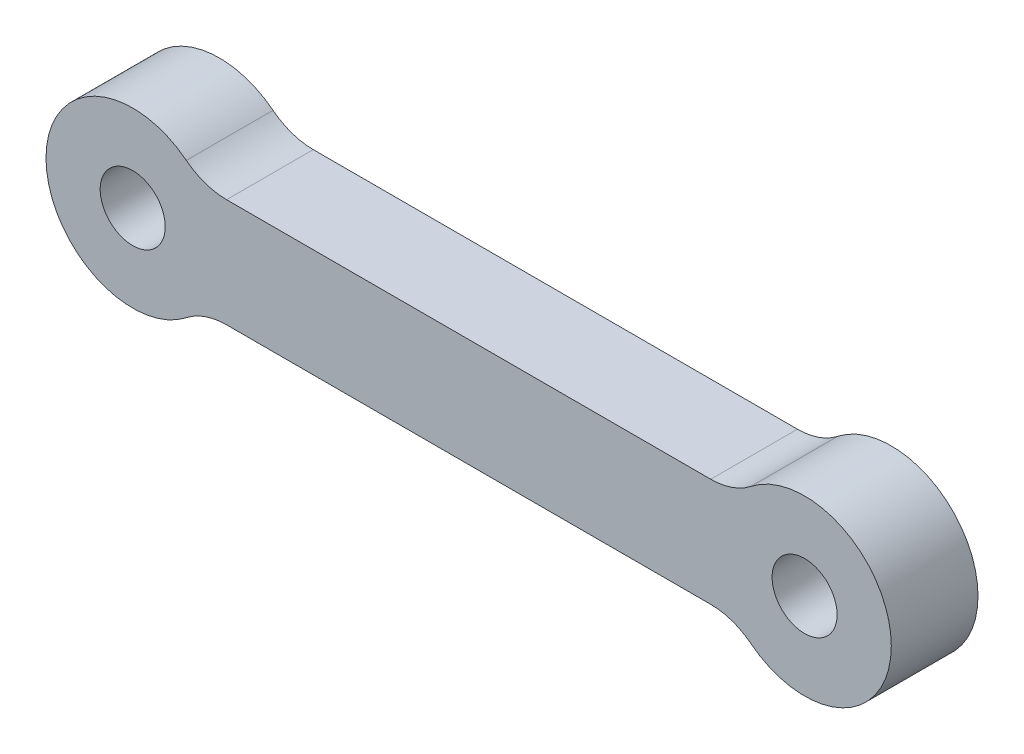
from build123d import *

# Parameters (mm, degrees)
SKETCH5_R           = 1.5
BOSS_EXTRUDE1_DEPTH = 4


with BuildPart() as part:
    # Sketch5 → Boss-Extrude1 (new body)
    with BuildSketch(Plane.XY):
        with BuildLine():
            Line((11.279796106, 0.837412737), (-11.059949856, 0.837412737))
            ThreePointArc((-11.059949856, 0.837412737), (-12.041930362, 1.00267919), (-12.915718579, 1.48026988))
            ThreePointArc((-12.915718579, 1.48026988), (-19.390076875, -1.662587263), (-12.915718579, -4.805444406))
            ThreePointArc((-12.915718579, -4.805444406), (-12.041930362, -4.327853715), (-11.059949856, -4.162587263))
            Line((-11.059949856, -4.162587263), (11.279796106, -4.162587263))
            ThreePointArc((11.279796106, -4.162587263), (12.261776612, -4.327853715), (13.135564828, -4.805444406))
            ThreePointArc((13.135564828, -4.805444406), (19.609923125, -1.662587263), (13.135564828, 1.48026988))
            ThreePointArc((13.135564828, 1.48026988), (12.261776612, 1.00267919), (11.279796106, 0.837412737))
        make_face()
        with Locations((-15.390076875, -1.662587263)):
            Circle(SKETCH5_R, mode=Mode.SUBTRACT)
        with Locations((15.609923125, -1.662587263)):
            Circle(SKETCH5_R, mode=Mode.SUBTRACT)
    extrude(amount=BOSS_EXTRUDE1_DEPTH)


solid = part.part
